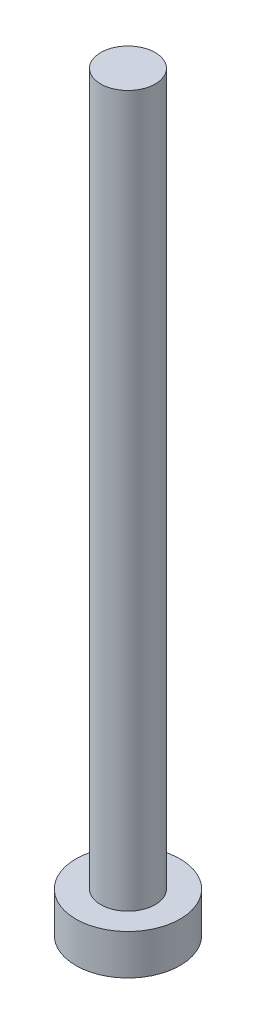
from build123d import *

# Parameters (mm, degrees)
SKETCH_1_R          = 2.2
EXTRUDE_1_DEPTH     = 1.7
EXTRUDE_START       = 1.7
SKETCH_1_4_R        = 1.15
EXTRUDE_2_DEPTH     = 30
SKETCH_1_3_W        = 1.7
SKETCH_1_3_H        = 0.5
SKETCH_1_3_W_2      = 0.5
SKETCH_1_3_H_2      = 1.7
CUT_EXTRUDE_1_DEPTH = 1.5


with BuildPart() as part:
    # 草图1 → 凸台-拉伸1 (new body)
    with BuildSketch(Plane(origin=(0, 0, 0), x_dir=(1, 0, 0), z_dir=(0, 1, 0))):
        with Locations(Location((0, 0, 0), (0, 0, 270))):
            Circle(SKETCH_1_R)
    extrude(amount=EXTRUDE_1_DEPTH)

    # 草图1<4> → 凸台-拉伸2 (add)
    with BuildSketch(Plane(origin=(0, 0, 0), x_dir=(1, 0, 0), z_dir=(0, 1, 0)).offset(EXTRUDE_START)):
        with Locations(Location((0, 0, 0), (0, 0, 270))):
            Circle(SKETCH_1_4_R)
    extrude(amount=EXTRUDE_2_DEPTH)

    # 草图1<3> → 切除-拉伸1 (cut)
    with BuildSketch(Plane(origin=(0, 0, 0), x_dir=(1, 0, 0), z_dir=(0, 1, 0))):
        Rectangle(SKETCH_1_3_W, SKETCH_1_3_H)
        Rectangle(SKETCH_1_3_W_2, SKETCH_1_3_H_2)
    extrude(amount=CUT_EXTRUDE_1_DEPTH, mode=Mode.SUBTRACT)


solid = part.part
